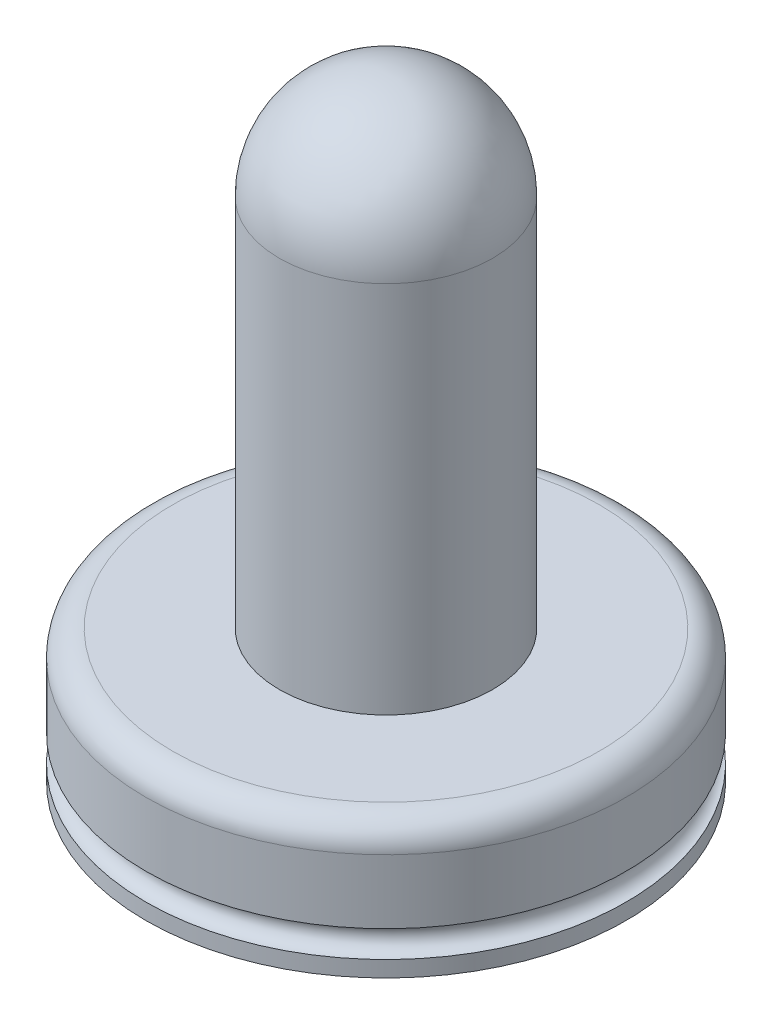
from build123d import *


with BuildPart() as part:
    # Sketch1 → Revolve-Thin1 (revolve)
    with BuildSketch(Plane.XY, mode=Mode.PRIVATE) as revolve_thin1_sk:
        with BuildLine():
            ThreePointArc((0, 23), (2.828427125, 21.828427125), (4, 19))
            Line((4, 19), (4, 5))
            Line((4, 5), (8, 5))
            ThreePointArc((8, 5), (8.707106781, 4.707106781), (9, 4))
            Line((9, 4), (9, 1.6))
            ThreePointArc((9, 1.6), (8.5, 1.1), (9, 0.6))
            Line((9, 0.6), (9, 0))
            Line((9, 0), (8.5, 0))
            Line((8.5, 0), (8.5, 0.233974596))
            ThreePointArc((8.5, 0.233974596), (8, 1.1), (8.5, 1.966025404))
            Line((8.5, 1.966025404), (8.5, 4))
            ThreePointArc((8.5, 4), (8.353553391, 4.353553391), (8, 4.5))
            Line((8, 4.5), (3.5, 4.5))
            Line((3.5, 4.5), (3.5, 19))
            ThreePointArc((3.5, 19), (2.474873734, 21.474873734), (0, 22.5))
            Line((0, 22.5), (0, 23))
        make_face()
    revolve(revolve_thin1_sk.sketch.rotate(Axis((0, 0, 0), (0, 1, 0)), 90), axis=Axis((0, 0, 0), (0, 1, 0)))


solid = part.part
